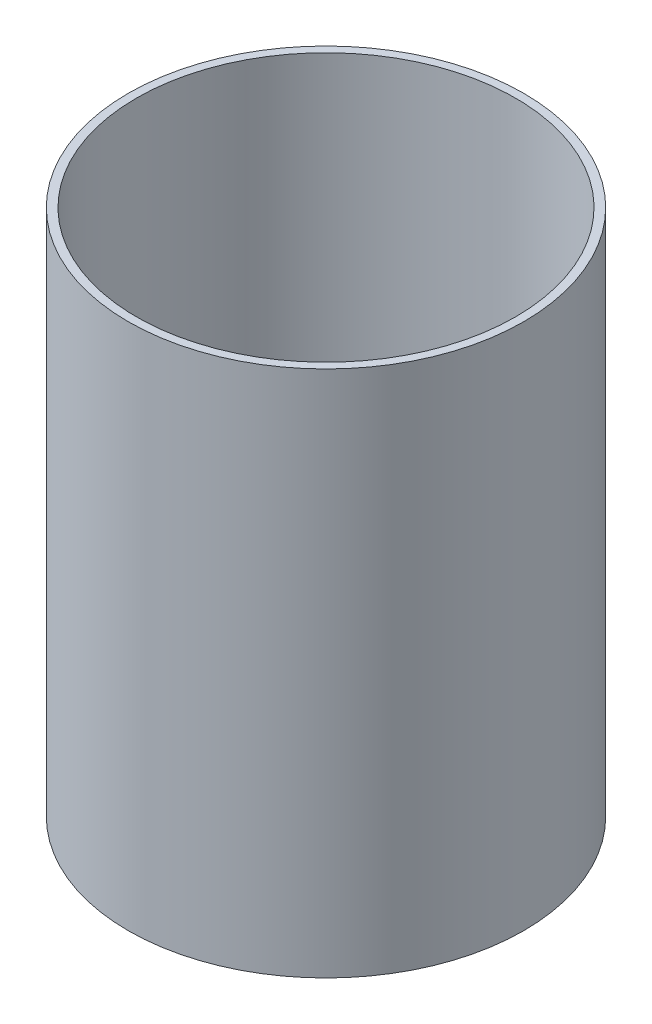
from build123d import *


with BuildPart() as part:
    # Sketch1 → Revolve1 (revolve)
    with BuildSketch(Plane.XY):
        Polygon((36.5125, 101.6), (36.5125, 3.175), (0, 3.175), (0, 0), (38.1, 0), (38.1, 101.6), align=None)
    revolve(axis=Axis((0, -1000, 0), (0, 1, 0)))


solid = part.part
